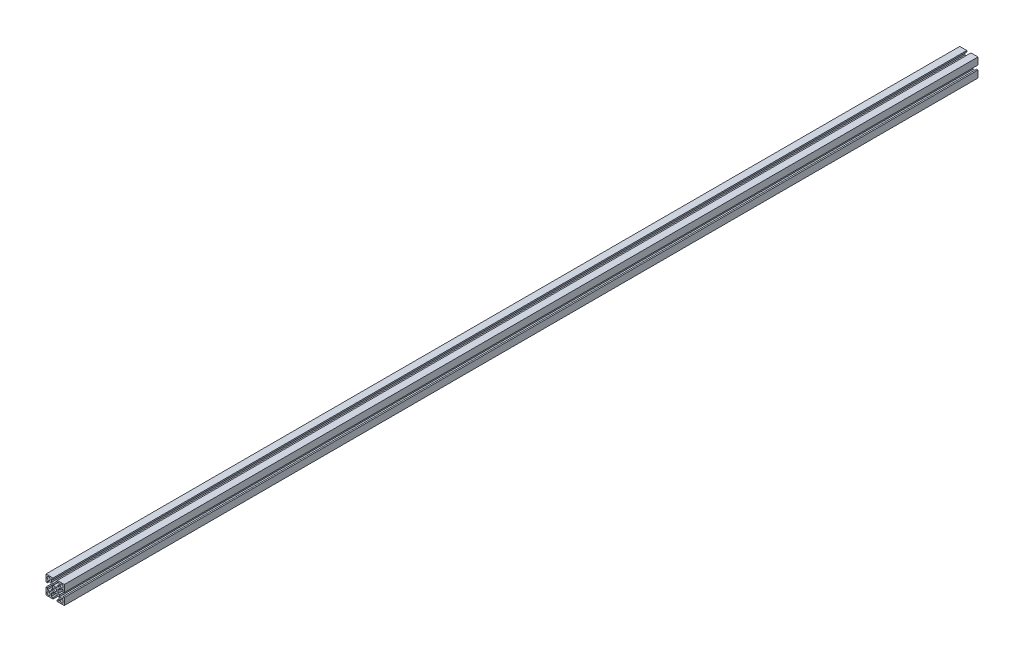
from build123d import *

# Parameters (mm, degrees)
SKETCH_1_R      = 1.65
SKETCH_1_R_2    = 1.75
EXTRUDE_1_DEPTH = 1000


with BuildPart() as part:
    # 草图1 → 凸台-拉伸1 (new body)
    with BuildSketch(Plane.XY):
        Polygon((-2.177197952, 9.242987377), (-9.877197952, 9.242987377), (-9.877197952, 1.542987377), (-8.377197952, 1.542987377), (-8.377197952, 3.492987377), (-4.677197952, 3.492987377), (-4.677197952, 1.542987377), (-2.777197952, 1.542987377), (-2.777197952, -3.057012623), (-4.677197952, -3.057012623), (-4.677197952, -5.007012623), (-8.377197952, -5.007012623), (-8.377197952, -3.057012623), (-9.877197952, -3.057012623), (-9.877197952, -10.757012623), (-2.177197952, -10.757012623), (-2.177197952, -9.257012623), (-4.127197952, -9.257012623), (-4.127197952, -5.557012623), (-2.177197952, -5.557012623), (-2.177197952, -3.657012623), (2.422802048, -3.657012623), (2.422802048, -5.557012623), (4.372802048, -5.557012623), (4.372802048, -9.257012623), (2.422802048, -9.257012623), (2.422802048, -10.757012623), (10.122802048, -10.757012623), (10.122802048, -3.057012623), (8.622802048, -3.057012623), (8.622802048, -5.007012623), (4.922802048, -5.007012623), (4.922802048, -3.057012623), (3.022802048, -3.057012623), (3.022802048, 1.542987377), (4.922802048, 1.542987377), (4.922802048, 3.492987377), (8.622802048, 3.492987377), (8.622802048, 1.542987377), (10.122802048, 1.542987377), (10.122802048, 9.242987377), (2.422802048, 9.242987377), (2.422802048, 7.742987377), (4.372802048, 7.742987377), (4.372802048, 4.042987377), (2.422802048, 4.042987377), (2.422802048, 2.142987377), (-2.177197952, 2.142987377), (-2.177197952, 4.042987377), (-4.127197952, 4.042987377), (-4.127197952, 7.742987377), (-2.177197952, 7.742987377), align=None)
        with Locations((0.122802048, -0.757012623)):
            Circle(SKETCH_1_R, mode=Mode.SUBTRACT)
        with Locations((-7.002197952, 6.367987377)):
            Circle(SKETCH_1_R_2, mode=Mode.SUBTRACT)
        with Locations((7.247802048, 6.367987377)):
            Circle(SKETCH_1_R_2, mode=Mode.SUBTRACT)
        with Locations((-7.002197952, -7.882012623)):
            Circle(SKETCH_1_R_2, mode=Mode.SUBTRACT)
        with Locations((7.247802048, -7.882012623)):
            Circle(SKETCH_1_R_2, mode=Mode.SUBTRACT)
    extrude(amount=EXTRUDE_1_DEPTH)


solid = part.part
